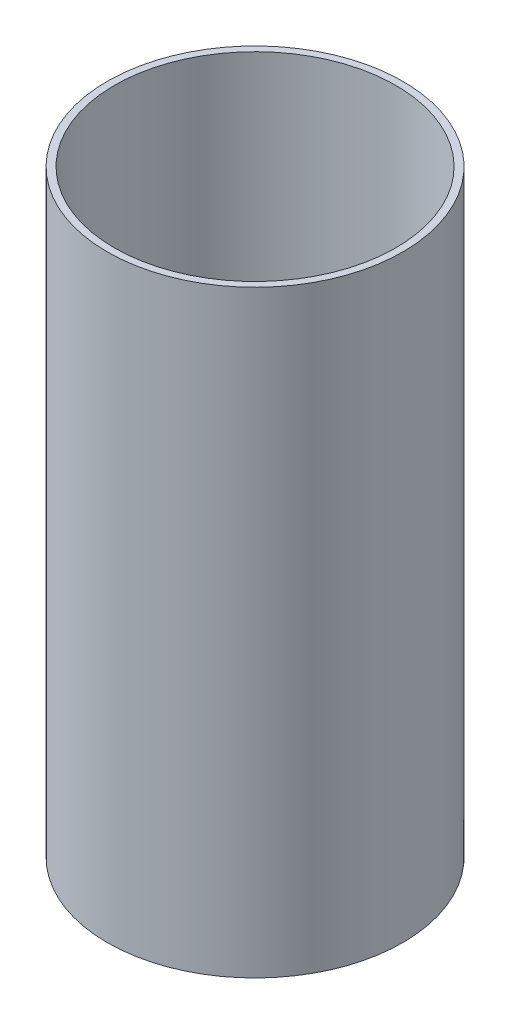
from build123d import *

# Parameters (mm, degrees)
SKETCH1_R           = 21
SKETCH1_R_2         = 20
BOSS_EXTRUDE1_DEPTH = 85


with BuildPart() as part:
    # Sketch1 → Boss-Extrude1 (new body)
    with BuildSketch(Plane(origin=(0, 0, 0), x_dir=(1, 0, 0), z_dir=(0, 1, 0))):
        with Locations(Location((0, 0, 0), (0, 0, 270))):
            Circle(SKETCH1_R)
        with Locations(Location((0, 0, 0), (0, 0, 270))):
            Circle(SKETCH1_R_2, mode=Mode.SUBTRACT)
    extrude(amount=BOSS_EXTRUDE1_DEPTH)


solid = part.part
